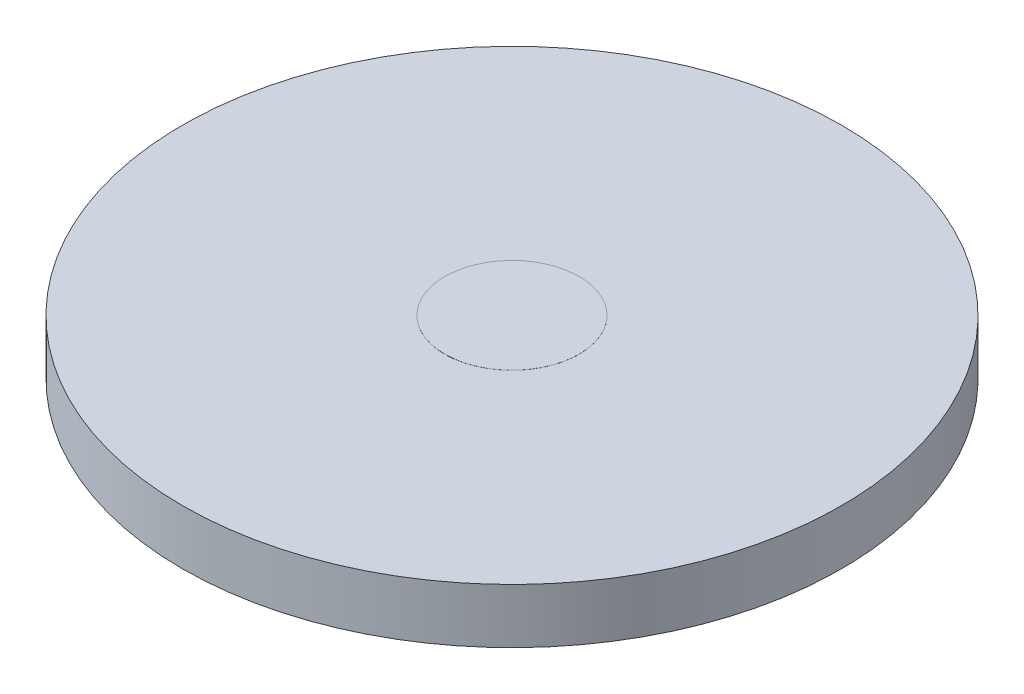
from build123d import *

# Parameters (mm, degrees)
SKETCH1_R                = 121.5
BOSS_EXTRUDE1_DEPTH      = 10.09
BOSS_EXTRUDE2_DEPTH      = 10.11
BOSS_EXTRUDE2_DEPTH_BACK = 10.39
SKETCH2_R                = 24.795


with BuildPart() as part:
    # Sketch1 → Boss-Extrude1 (new, symmetric)
    with BuildSketch(Plane(origin=(0, 0, 0), x_dir=(1, 0, 0), z_dir=(0, 1, 0))):
        with Locations(Location((0, 0, 0), (0, 0, 270))):
            Circle(SKETCH1_R)
    extrude(amount=BOSS_EXTRUDE1_DEPTH, both=True)

    # Sketch2 → Boss-Extrude2 (add, two sides: drawn at the far end of the back side and taken through both)
    with BuildSketch(Plane(origin=(0, 0, 0), x_dir=(1, 0, 0), z_dir=(0, 1, 0)).offset(-BOSS_EXTRUDE2_DEPTH_BACK)):
        with Locations(Location((0, 0, 0), (0, 0, 270))):
            Circle(SKETCH2_R)
    extrude(amount=BOSS_EXTRUDE2_DEPTH + BOSS_EXTRUDE2_DEPTH_BACK)


solid = part.part
